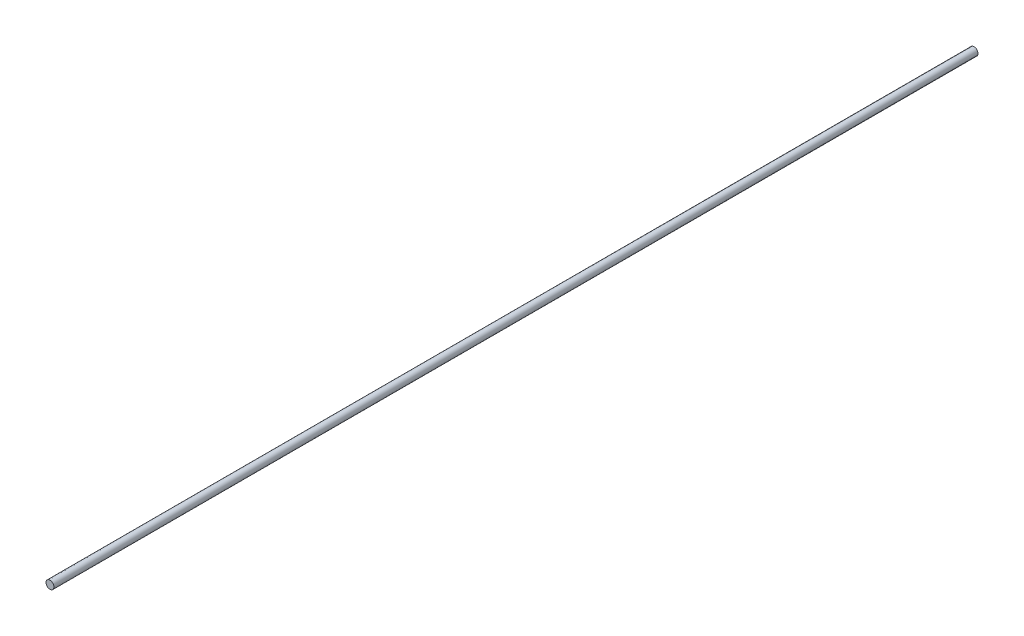
from build123d import *

# Parameters (mm, degrees)
SKETCH_1_R      = 2.999515394
EXTRUDE_1_DEPTH = 700


with BuildPart() as part:
    # Эскиз1 → Бобышка-Вытянуть1 (new body)
    with BuildSketch(Plane(origin=(0, 0, 0), x_dir=(-1, 0, 0), z_dir=(0, 0, 1))):
        with Locations(Location((-6.5, 15.25, 0), (0, 0, 180))):
            Circle(SKETCH_1_R)
    extrude(amount=EXTRUDE_1_DEPTH)


solid = part.part
